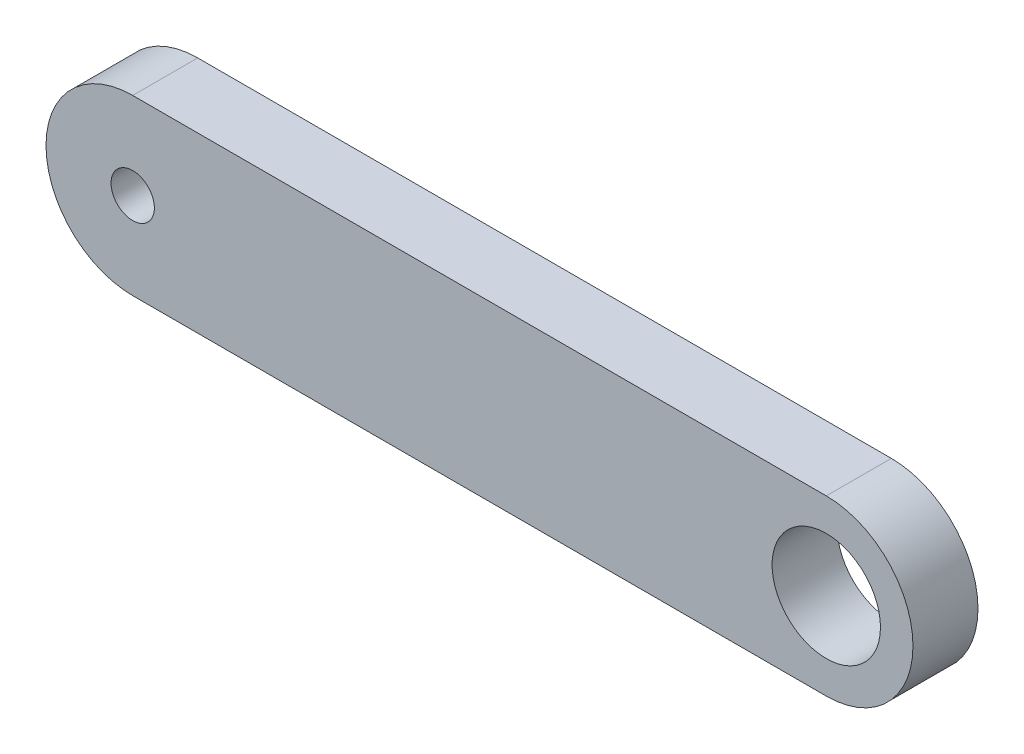
from build123d import *

# Parameters (mm, degrees)
SKETCH1_R           = 1
SKETCH1_R_2         = 2.5
BOSS_EXTRUDE1_DEPTH = 3


with BuildPart() as part:
    # Sketch1 → Boss-Extrude1 (new body)
    with BuildSketch(Plane.XY):
        with BuildLine():
            Line((-16, 4), (16, 4))
            ThreePointArc((16, 4), (20, 0), (16, -4))
            Line((16, -4), (-16, -4))
            ThreePointArc((-16, -4), (-20, 0), (-16, 4))
        make_face()
        with Locations((-16, 0)):
            Circle(SKETCH1_R, mode=Mode.SUBTRACT)
        with Locations((16, 0)):
            Circle(SKETCH1_R_2, mode=Mode.SUBTRACT)
    extrude(amount=BOSS_EXTRUDE1_DEPTH)


solid = part.part
